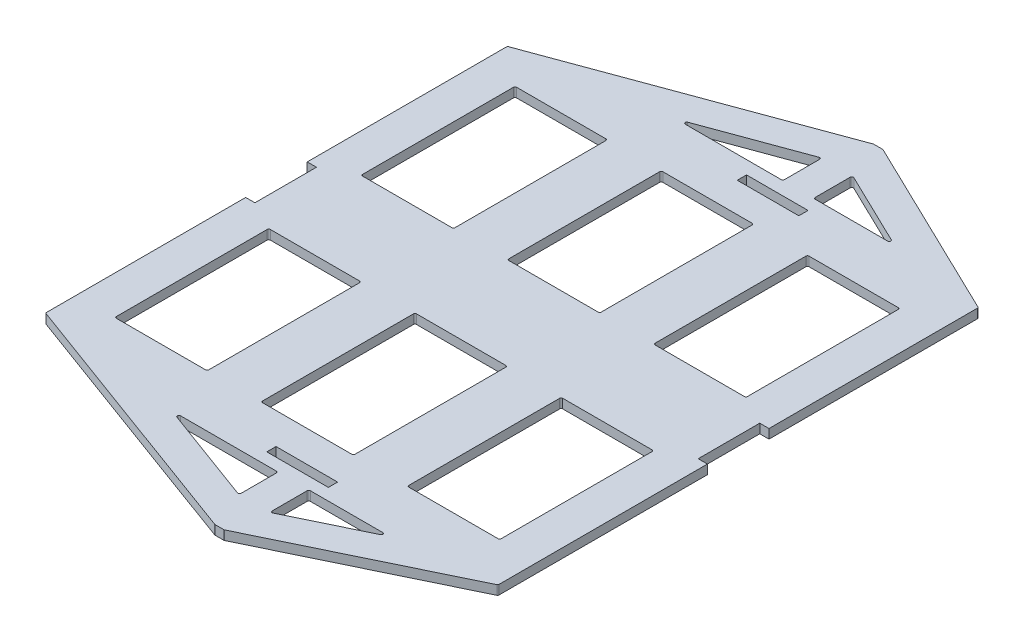
from build123d import *

# Parameters (mm, degrees)
SUPPORT_DEPTH = 6
SKETCH2_W     = 60
SKETCH2_H     = 100
LITE_DEPTH    = 468.118828565
FILLET1_R     = 1
FILLET2_R     = 1
SKETCH3_W     = 6
SKETCH3_H     = 40
SKETCH3_W_2   = 40
SKETCH3_H_2   = 6
MOUNT_DEPTH   = 468.118828565


with BuildPart() as part:
    # Sketch1 → support (new body)
    with BuildSketch(Plane(origin=(0, 0, 0), x_dir=(1, 0, 0), z_dir=(0, 1, 0))):
        Polygon((300, 0), (300, -12), (180, -70), (174, -70), (0, -6), (0, 0), (0, 288), (0, 294), (174, 358), (180, 358), (300, 300), (300, 288), align=None)
    extrude(amount=SUPPORT_DEPTH)

    # Sketch2 → lite (cut, through all)
    with BuildSketch(Plane(origin=(0, 6, 0), x_dir=(1, 0, 0), z_dir=(0, 1, 0))):
        Polygon((95.999022376, -20), (164.988314579, -20), (164.988314579, -45.375371845), align=None)
        Polygon((184.988314579, -20), (184.988314579, -45.375371845), (237.489083913, -20), align=None)
        Polygon((95.999022376, 308), (164.988314579, 333.375371845), (164.988314579, 308), align=None)
        Polygon((184.988314579, 333.375371845), (237.489083913, 308), (184.988314579, 308), align=None)
        with Locations((245, 64)):
            Rectangle(SKETCH2_W, SKETCH2_H)
        with Locations((150, 64)):
            Rectangle(SKETCH2_W, SKETCH2_H)
        with Locations((55, 64)):
            Rectangle(SKETCH2_W, SKETCH2_H)
        with Locations((55, 224)):
            Rectangle(SKETCH2_W, SKETCH2_H)
        with Locations((150, 224)):
            Rectangle(SKETCH2_W, SKETCH2_H)
        with Locations((245, 224)):
            Rectangle(SKETCH2_W, SKETCH2_H)
    extrude(amount=-LITE_DEPTH, mode=Mode.SUBTRACT)

    # Fillet1
    fillet1_edges = [part.edges().sort_by_distance(p)[0] for p in [
        (0, 3, -294),
        (174, 3, -358),
        (180, 3, -358),
        (300, 3, -300),
        (300, 3, 12),
        (180, 3, 70),
        (174, 3, 70),
        (0, 3, 6),
    ]]
    fillet(fillet1_edges, radius=FILLET1_R)

    # Fillet2
    fillet2_edges = [part.edges().sort_by_distance(p)[0] for p in [
        (85, 3, -114),
        (85, 3, -14),
        (25, 3, -14),
        (25, 3, -114),
        (85, 3, -274),
        (85, 3, -174),
        (25, 3, -174),
        (25, 3, -274),
        (180, 3, -274),
        (180, 3, -174),
        (120, 3, -174),
        (120, 3, -274),
        (275, 3, -274),
        (275, 3, -174),
        (215, 3, -174),
        (215, 3, -274),
        (164.988314579, 3, 45.375371845),
        (95.999022376, 3, 20),
        (164.988314579, 3, 20),
        (184.988314579, 3, 20),
        (237.489083913, 3, 20),
        (184.988314579, 3, 45.375371845),
        (164.988314579, 3, -308),
        (95.999022376, 3, -308),
        (164.988314579, 3, -333.375371845),
        (184.988314579, 3, -308),
        (184.988314579, 3, -333.375371845),
        (237.489083913, 3, -308),
        (275, 3, -114),
        (275, 3, -14),
        (215, 3, -14),
        (215, 3, -114),
        (180, 3, -114),
        (180, 3, -14),
        (120, 3, -14),
        (120, 3, -114),
    ]]
    fillet(fillet2_edges, radius=FILLET2_R)

    # Sketch3 → mount (cut, through all)
    with BuildSketch(Plane(origin=(0, 6, 0), x_dir=(1, 0, 0), z_dir=(0, 1, 0))):
        with Locations((3, 144)):
            Rectangle(SKETCH3_W, SKETCH3_H)
        with Locations((297, 144)):
            Rectangle(SKETCH3_W, SKETCH3_H)
        with Locations((170, -9.273001814)):
            Rectangle(SKETCH3_W_2, SKETCH3_H_2)
        with Locations((170, 296.372652861)):
            Rectangle(SKETCH3_W_2, SKETCH3_H_2)
    extrude(amount=-MOUNT_DEPTH, mode=Mode.SUBTRACT)


solid = part.part
